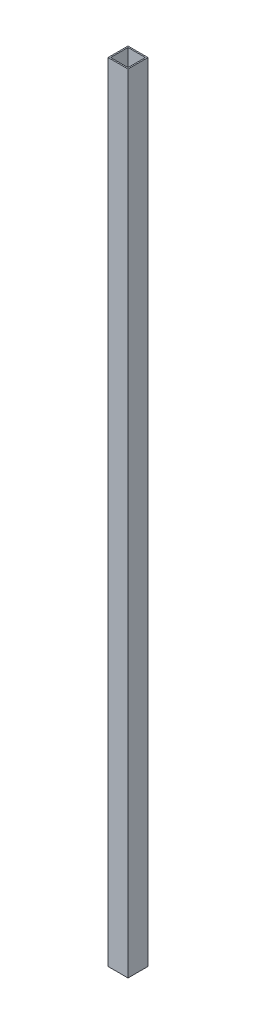
from build123d import *

# Parameters (mm, degrees)
SKETCH1_W           = 25.4
SKETCH1_H           = 25.4
SKETCH1_W_2         = 22.225
SKETCH1_H_2         = 22.225
BOSS_EXTRUDE2_DEPTH = 1003.3


with BuildPart() as part:
    # Sketch1 → Boss-Extrude2 (new body)
    with BuildSketch(Plane(origin=(0, 0, 0), x_dir=(1, 0, 0), z_dir=(0, 1, 0))):
        Rectangle(SKETCH1_W, SKETCH1_H)
        Rectangle(SKETCH1_W_2, SKETCH1_H_2, mode=Mode.SUBTRACT)
    extrude(amount=BOSS_EXTRUDE2_DEPTH)


solid = part.part
